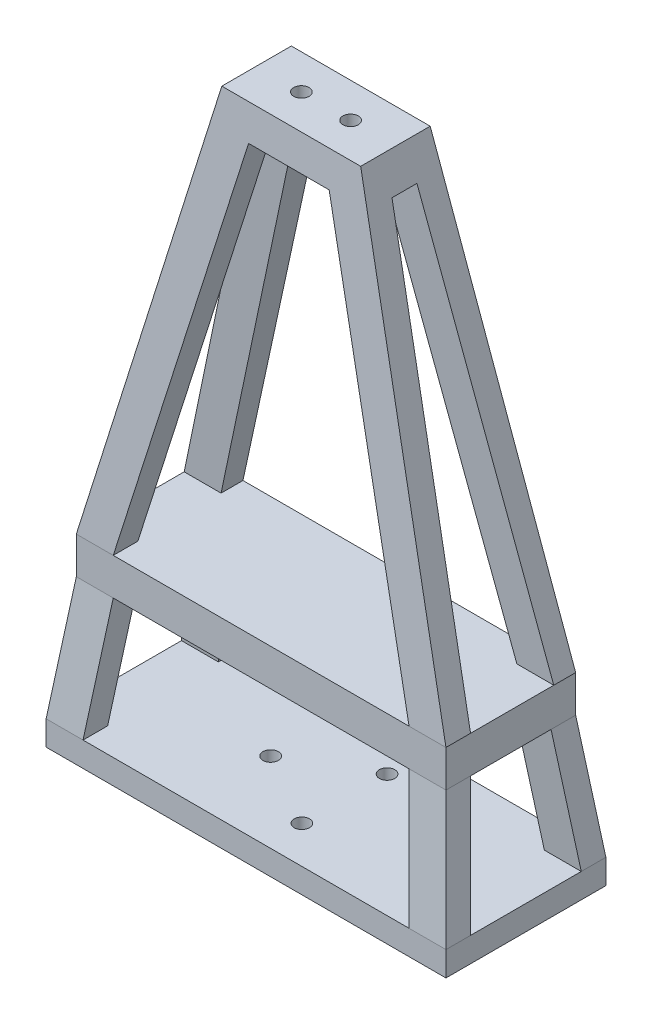
from build123d import *

# Parameters (mm, degrees)
SKETCH1_W                 = 65
SKETCH1_H                 = 26
BOSS_EXTRUDE1_DEPTH       = 4
F_2_5MM_DOWEL_HOLE1_D     = 2.5
F_2_5MM_DOWEL_HOLE1_DEPTH = 5
F_2_5MM_DOWEL_HOLE1_TIP   = 0.751075774
SKETCH6_W                 = 65
SKETCH6_H                 = 26
BOSS_EXTRUDE2_DEPTH       = 20
BOSS_EXTRUDE2_TAPER       = 7
SKETCH7_W                 = 48.088617564
SKETCH7_H                 = 13.088617564
CUT_EXTRUDE1_DEPTH        = 20
CUT_EXTRUDE1_DRAFT        = 7
CUT_EXTRUDE3_DEPTH        = 33
CUT_EXTRUDE4_DEPTH        = 70
SKETCH11_W                = 60.088617564
SKETCH11_H                = 21.088617564
BOSS_EXTRUDE3_DEPTH       = 6
SKETCH12_W                = 60.088617564
SKETCH12_H                = 21.088617564
BOSS_EXTRUDE5_DEPTH       = 70
BOSS_EXTRUDE5_TAPER       = 4
CUT_EXTRUDE5_DEPTH        = 55
CUT_EXTRUDE6_DEPTH        = 67
F_2_5MM_DOWEL_HOLE2_D     = 2.5
F_2_5MM_DOWEL_HOLE2_DEPTH = 5
F_2_5MM_DOWEL_HOLE2_TIP   = 0.751075774


with BuildPart() as part:
    # Sketch1 → Boss-Extrude1 (new body)
    with BuildSketch(Plane(origin=(0, 0, 0), x_dir=(1, 0, 0), z_dir=(0, 1, 0))):
        with Locations((32.5, 13)):
            Rectangle(SKETCH1_W, SKETCH1_H)
    extrude(amount=BOSS_EXTRUDE1_DEPTH)

    # Ø2.5mm Dowel Hole1
    with Locations(Plane(origin=(23.5, 4, -13), x_dir=(0, 0, 1), z_dir=(0, 1, 0))):
        with Locations((0, 0), (-6.92820323, 12), (6.92820323, 12)):
            Hole(F_2_5MM_DOWEL_HOLE1_D / 2, depth=F_2_5MM_DOWEL_HOLE1_DEPTH)
            with Locations((0, 0, -(F_2_5MM_DOWEL_HOLE1_DEPTH + F_2_5MM_DOWEL_HOLE1_TIP / 2))):  # 118° drill point
                Cone(0, F_2_5MM_DOWEL_HOLE1_D / 2, F_2_5MM_DOWEL_HOLE1_TIP, mode=Mode.SUBTRACT)

    # Sketch6 → Boss-Extrude2 (add)
    with BuildSketch(Plane(origin=(0, 4, 0), x_dir=(1, 0, 0), z_dir=(0, 1, 0))):
        with Locations((32.5, 13)):
            Rectangle(SKETCH6_W, SKETCH6_H)
    extrude(amount=BOSS_EXTRUDE2_DEPTH, taper=BOSS_EXTRUDE2_TAPER)


with BuildPart() as cut_extrude1_tool:
    # Sketch7 → Cut-Extrude1 (with draft: the straight prism first)
    with BuildSketch(Plane(origin=(0, 24, 0), x_dir=(1, 0, 0), z_dir=(0, 1, 0))):
        with Locations((32.5, 13)):
            Rectangle(SKETCH7_W, SKETCH7_H)
    extrude(amount=-CUT_EXTRUDE1_DEPTH)
    # Cut-Extrude1: the draft: its side faces are tilted about the plane it starts from
    cut_extrude1_sides = [cut_extrude1_tool.faces().sort_by_distance(p)[0] for p in [
        (8.455691218, 14, -13),
        (32.5, 14, -6.455691218),
        (56.544308782, 14, -13),
        (32.5, 14, -19.544308782),
    ]]
    draft(cut_extrude1_sides, Plane(origin=(0, 24, 0), x_dir=(1, 0, 0), z_dir=(0, 1, 0)), CUT_EXTRUDE1_DRAFT)


with BuildPart() as part_1:
    add(part.part)

    # Cut-Extrude1: cut by cut_extrude1_tool
    add(cut_extrude1_tool.part, mode=Mode.SUBTRACT)

    # Sketch9 → Cut-Extrude3 (cut)
    with BuildSketch(Plane(origin=(0, 0, -26), x_dir=(-1, 0, 0), z_dir=(0, 0, -1))):
        Polygon((-59, 4), (-6, 4), (-8.455691218, 24), (-56.544308782, 24), align=None)
    extrude(amount=-CUT_EXTRUDE3_DEPTH, mode=Mode.SUBTRACT)

    # Sketch10 → Cut-Extrude4 (cut)
    with BuildSketch(Plane(origin=(65, 0, 0), x_dir=(0, 0, -1), z_dir=(1, 0, 0))):
        Polygon((4, 4), (22, 4), (19.544308782, 24), (6.455691218, 24), align=None)
    extrude(amount=-CUT_EXTRUDE4_DEPTH, mode=Mode.SUBTRACT)

    # Sketch11 → Boss-Extrude3 (add)
    with BuildSketch(Plane(origin=(0, 24, 0), x_dir=(1, 0, 0), z_dir=(0, 1, 0))):
        with Locations((32.5, 13)):
            Rectangle(SKETCH11_W, SKETCH11_H)
    extrude(amount=BOSS_EXTRUDE3_DEPTH)

    # Sketch12 → Boss-Extrude5 (add)
    with BuildSketch(Plane(origin=(0, 30, 0), x_dir=(1, 0, 0), z_dir=(0, 1, 0))):
        with Locations((32.5, 13)):
            Rectangle(SKETCH12_W, SKETCH12_H)
    extrude(amount=BOSS_EXTRUDE5_DEPTH, taper=BOSS_EXTRUDE5_TAPER)

    # Sketch13 → Cut-Extrude5 (cut)
    with BuildSketch(Plane(origin=(0, 0, -23.544308782), x_dir=(-1, 0, 0), z_dir=(0, 0, -1))):
        Polygon((-62.544308782, 30), (-43.787865312, 100), (-62.544308782, 100), align=None)
        Polygon((-2.455691218, 30), (-21.212134688, 100), (-2.455691218, 100), align=None)
        Polygon((-39.049928788, 94.5), (-25.950071212, 94.5), (-8.455691218, 30), (-56.544308782, 30), align=None)
    extrude(amount=-CUT_EXTRUDE5_DEPTH, mode=Mode.SUBTRACT)

    # Sketch14 → Cut-Extrude6 (cut)
    with BuildSketch(Plane(origin=(62.544308782, 0, 0), x_dir=(0, 0, -1), z_dir=(1, 0, 0))):
        Polygon((6.455691218, 30), (19.986565131, 30), (15.024261819, 94.5), (10.965970588, 94.5), align=None)
    extrude(amount=-CUT_EXTRUDE6_DEPTH, mode=Mode.SUBTRACT)

    # Ø2.5mm Dowel Hole2
    with Locations(Plane(origin=(0, 100, 0), x_dir=(1, 0, 0), z_dir=(0, 1, 0))):
        with Locations((28.5, 13), (36.5, 13)):
            Hole(F_2_5MM_DOWEL_HOLE2_D / 2, depth=F_2_5MM_DOWEL_HOLE2_DEPTH)
            with Locations((0, 0, -(F_2_5MM_DOWEL_HOLE2_DEPTH + F_2_5MM_DOWEL_HOLE2_TIP / 2))):  # 118° drill point
                Cone(0, F_2_5MM_DOWEL_HOLE2_D / 2, F_2_5MM_DOWEL_HOLE2_TIP, mode=Mode.SUBTRACT)


solid = part_1.part
